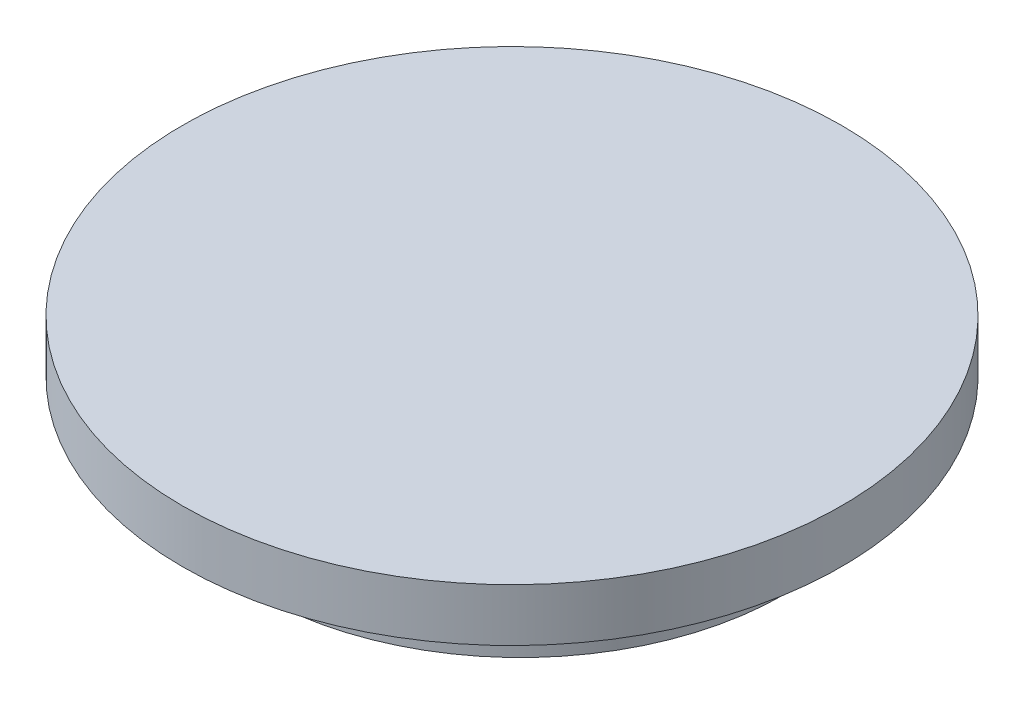
from build123d import *

# Parameters (mm, degrees)
SKETCH1_R           = 20
BOSS_EXTRUDE1_DEPTH = 4
SKETCH2_R           = 25
BOSS_EXTRUDE2_DEPTH = 4


with BuildPart() as part:
    # Sketch1 → Boss-Extrude1 (new body)
    with BuildSketch(Plane(origin=(0, 0, 0), x_dir=(1, 0, 0), z_dir=(0, 1, 0))):
        with Locations(Location((0, 0, 0), (0, 0, 270))):
            Circle(SKETCH1_R)
    extrude(amount=BOSS_EXTRUDE1_DEPTH)

    # Sketch2 → Boss-Extrude2 (add)
    with BuildSketch(Plane(origin=(0, 4, 0), x_dir=(1, 0, 0), z_dir=(0, 1, 0))):
        with Locations(Location((-0.65, 0, 0), (0, 0, 270))):
            Circle(SKETCH2_R)
    extrude(amount=BOSS_EXTRUDE2_DEPTH)


solid = part.part
